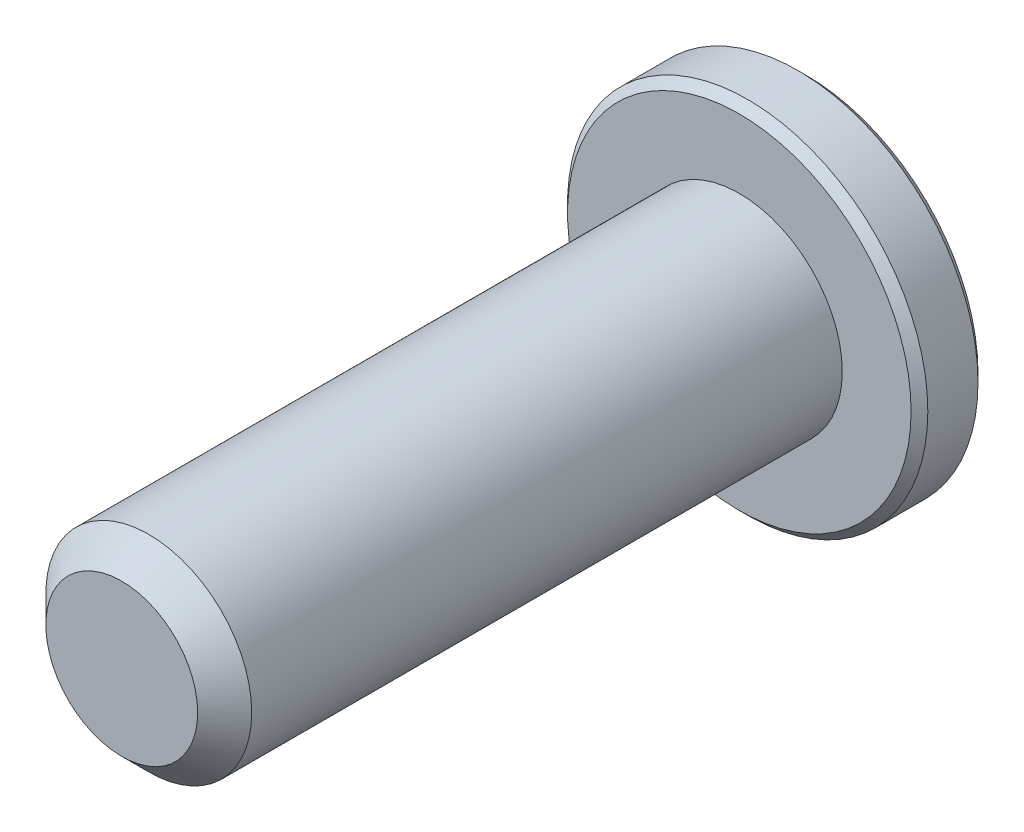
from build123d import *

# Parameters (mm, degrees)
EXTRUDE1_START     = -5.35
SKETCH1_R          = 2
EXTRUDE1_DEPTH     = 12
EXTRUDE2_START     = -6.65
SKETCH6_R          = 3.5
EXTRUDE2_DEPTH     = 1.3
CUT_EXTRUDE1_DEPTH = 0.975
SKETCH8_R          = 1.443375673
CUT_EXTRUDE2_DEPTH = 0.975
CUT_EXTRUDE2_TAPER = 45
CHAMFER1_SIZE      = 0.1625
CHAMFER2_SIZE      = 0.525


with BuildPart() as part:
    # Sketch1 → Extrude1 (new body)
    with BuildSketch(Plane.XY.offset(EXTRUDE1_START)):
        Circle(SKETCH1_R)
    extrude(amount=EXTRUDE1_DEPTH)

    # Sketch6 → Extrude2 (add)
    with BuildSketch(Plane.XY.offset(EXTRUDE2_START)):
        Circle(SKETCH6_R)
    extrude(amount=EXTRUDE2_DEPTH)

    # Sketch7 → Cut-Extrude1 (cut)
    with BuildSketch(Plane.XY.offset(-6.65)):
        Polygon((0, 1.443375673), (-1.25, 0.721687836), (-1.25, -0.721687836), (0, -1.443375673), (1.25, -0.721687836), (1.25, 0.721687836), align=None)
    extrude(amount=CUT_EXTRUDE1_DEPTH, mode=Mode.SUBTRACT)

    # Sketch8 → Cut-Extrude2 (cut)
    with BuildSketch(Plane.XY.offset(-6.65)):
        Circle(SKETCH8_R)
    extrude(amount=CUT_EXTRUDE2_DEPTH, taper=CUT_EXTRUDE2_TAPER, mode=Mode.SUBTRACT)

    # Chamfer1
    chamfer1_edges = [part.edges().sort_by_distance(p)[0] for p in [
        (-3.5, 0, -5.35),
        (-3.5, 0, -6.65),
    ]]
    chamfer(chamfer1_edges, length=CHAMFER1_SIZE)

    # Chamfer2
    chamfer2_edges = [part.edges().sort_by_distance(p)[0] for p in [
        (-2, 0, 6.65),
    ]]
    chamfer(chamfer2_edges, length=CHAMFER2_SIZE)


solid = part.part
